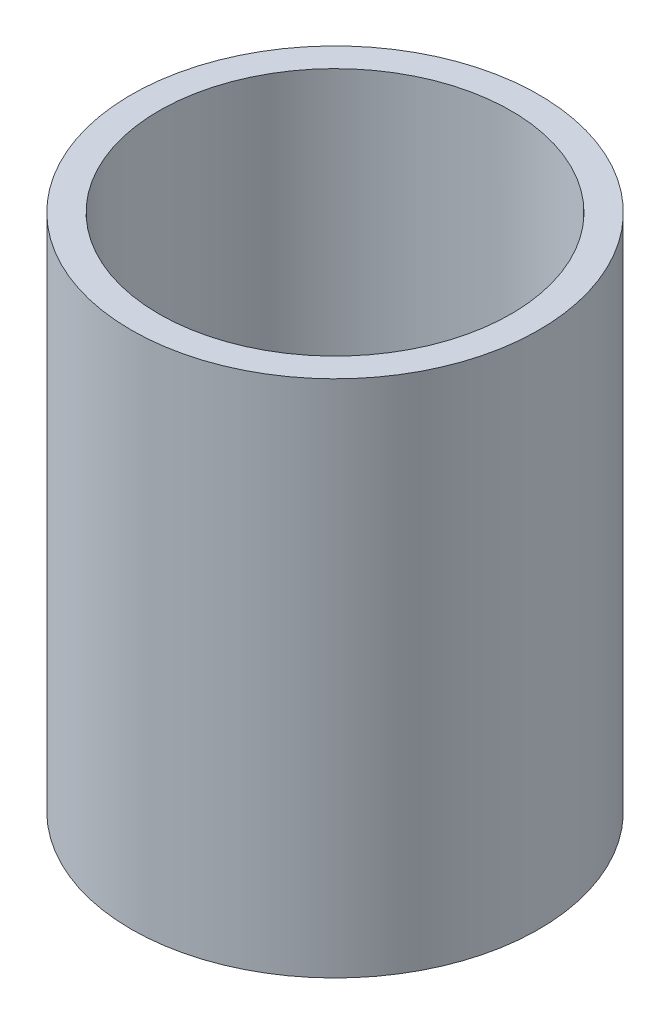
from build123d import *

# Parameters (mm, degrees)
SKETCH1_R           = 11
SKETCH1_R_2         = 9.5
BOSS_EXTRUDE1_DEPTH = 14
SKETCH2_R           = 2
CUT_EXTRUDE1_DEPTH  = 28


with BuildPart() as part:
    # Sketch1 → Boss-Extrude1 (new, symmetric)
    with BuildSketch(Plane(origin=(0, 0, 0), x_dir=(1, 0, 0), z_dir=(0, 1, 0))):
        with Locations(Location((0, 0, 0), (0, 0, 270))):
            Circle(SKETCH1_R)
        with Locations(Location((0, 0, 0), (0, 0, 270))):
            Circle(SKETCH1_R_2, mode=Mode.SUBTRACT)
    extrude(amount=BOSS_EXTRUDE1_DEPTH, both=True)

    # Sketch2 → Cut-Extrude1 (cut)
    with BuildSketch(Plane.XY):
        with Locations(Location((0, 0, 0), (0, 0, 90))):
            Circle(SKETCH2_R)
    extrude(amount=-CUT_EXTRUDE1_DEPTH, mode=Mode.SUBTRACT)


solid = part.part
